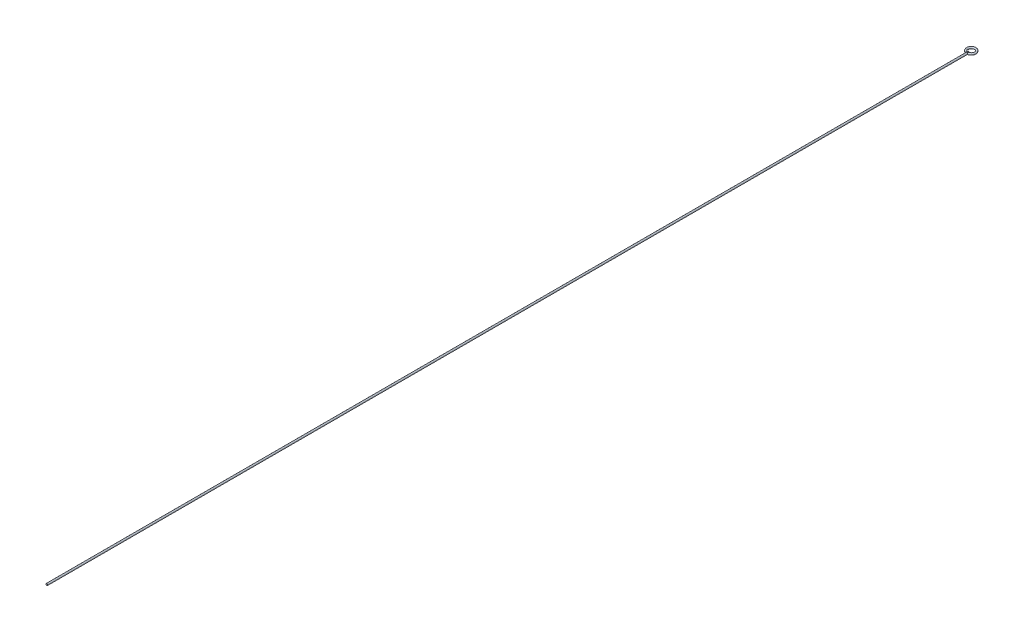
from build123d import *

# Parameters (mm, degrees)
BOSS_EXTRUDE1_START = 6
SKETCH1_R           = 2
BOSS_EXTRUDE1_DEPTH = 2125
SKETCH4_R           = 2
SKETCH7_R           = 2
BOSS_EXTRUDE2_DEPTH = 2.1


with BuildPart() as part:
    # Sketch1 → Boss-Extrude1 (new body)
    with BuildSketch(Plane.XY.offset(BOSS_EXTRUDE1_START)):
        Circle(SKETCH1_R)
    extrude(amount=BOSS_EXTRUDE1_DEPTH)

    # Sketch4 → Revolve1 (revolve)
    with BuildSketch(Plane(origin=(0, 0, 0), x_dir=(-1, 0, 0), z_dir=(0, 0, -1)), mode=Mode.PRIVATE) as revolve1_sk:
        with Locations((-9, 0)):
            Circle(SKETCH4_R)
    revolve(revolve1_sk.sketch.rotate(Axis((0, 3.776003841, 0), (0, -1, 0)), 269.999990329), axis=Axis((0, 3.776003841, 0), (0, -1, 0)))

    # Sketch7 → Boss-Extrude2 (add)
    with BuildSketch(Plane(origin=(0, 0, 0), x_dir=(1, 0, 0), z_dir=(0, 1, 0))):
        with Locations(Location((0, -9, 0), (0, 0, 132.556740857))):
            Circle(SKETCH7_R)
    extrude(amount=BOSS_EXTRUDE2_DEPTH)


solid = part.part
